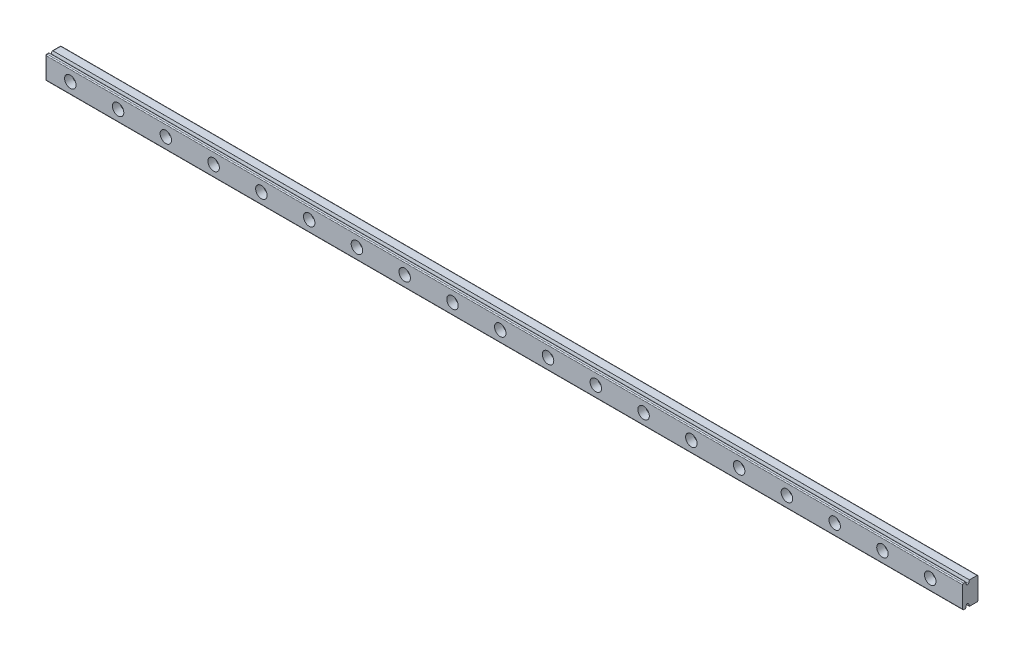
from build123d import *
from OCP.BRepFilletAPI import BRepFilletAPI_MakeChamfer

# Parameters (mm, degrees)
BOSS_EXTRUDE1_DEPTH = 500
SKETCH2_R           = 1.75
CUT_EXTRUDE1_DEPTH  = 10
SKETCH3_R           = 3
CUT_EXTRUDE2_DEPTH  = 4
CHAMFER1_SIZE       = 0.5
CHAMFER1_SIZE2      = 1.743707222
FILLET1_R           = 0.5
SKETCH_2_W          = 13.160064583
SKETCH_2_H          = 15.469848399
CUT_EXTRUDE_2_DEPTH = 20


with BuildPart() as part:
    # Sketch1 → Boss-Extrude1 (new body)
    with BuildSketch(Plane(origin=(0, 0, 0), x_dir=(0, 0, -1), z_dir=(1, 0, 0))):
        Polygon((-0.5, 6), (4, 6), (4, -6), (-0.5, -6), (-0.5, -4.25), (-2.5, -4.25), (-2.5, -6), (-4, -6), (-4, 6), (-2.5, 6), (-2.5, 4.25), (-0.5, 4.25), align=None)
    extrude(amount=BOSS_EXTRUDE1_DEPTH)

    # Sketch2 → Cut-Extrude1 (cut)
    with BuildSketch(Plane.XY.offset(4)):
        with Locations((13, 0)):
            Circle(SKETCH2_R)
        with Locations((38, 0)):
            Circle(SKETCH2_R)
        with Locations((63, 0)):
            Circle(SKETCH2_R)
        with Locations((88, 0)):
            Circle(SKETCH2_R)
        with Locations((113, 0)):
            Circle(SKETCH2_R)
        with Locations((138, 0)):
            Circle(SKETCH2_R)
        with Locations((163, 0)):
            Circle(SKETCH2_R)
        with Locations((188, 0)):
            Circle(SKETCH2_R)
        with Locations((213, 0)):
            Circle(SKETCH2_R)
        with Locations((238, 0)):
            Circle(SKETCH2_R)
        with Locations((263, 0)):
            Circle(SKETCH2_R)
        with Locations((288, 0)):
            Circle(SKETCH2_R)
        with Locations((313, 0)):
            Circle(SKETCH2_R)
        with Locations((338, 0)):
            Circle(SKETCH2_R)
        with Locations((363, 0)):
            Circle(SKETCH2_R)
        with Locations((388, 0)):
            Circle(SKETCH2_R)
        with Locations((413, 0)):
            Circle(SKETCH2_R)
        with Locations((438, 0)):
            Circle(SKETCH2_R)
        with Locations((463, 0)):
            Circle(SKETCH2_R)
        with Locations((488, 0)):
            Circle(SKETCH2_R)
    extrude(amount=-CUT_EXTRUDE1_DEPTH, mode=Mode.SUBTRACT)

    # Sketch3 → Cut-Extrude2 (cut)
    with BuildSketch(Plane.XY.offset(4)):
        with Locations((13, 0)):
            Circle(SKETCH3_R)
        with Locations((38, 0)):
            Circle(SKETCH3_R)
        with Locations((63, 0)):
            Circle(SKETCH3_R)
        with Locations((88, 0)):
            Circle(SKETCH3_R)
        with Locations((113, 0)):
            Circle(SKETCH3_R)
        with Locations((138, 0)):
            Circle(SKETCH3_R)
        with Locations((163, 0)):
            Circle(SKETCH3_R)
        with Locations((188, 0)):
            Circle(SKETCH3_R)
        with Locations((213, 0)):
            Circle(SKETCH3_R)
        with Locations((238, 0)):
            Circle(SKETCH3_R)
        with Locations((263, 0)):
            Circle(SKETCH3_R)
        with Locations((288, 0)):
            Circle(SKETCH3_R)
        with Locations((313, 0)):
            Circle(SKETCH3_R)
        with Locations((338, 0)):
            Circle(SKETCH3_R)
        with Locations((363, 0)):
            Circle(SKETCH3_R)
        with Locations((388, 0)):
            Circle(SKETCH3_R)
        with Locations((413, 0)):
            Circle(SKETCH3_R)
        with Locations((438, 0)):
            Circle(SKETCH3_R)
        with Locations((463, 0)):
            Circle(SKETCH3_R)
        with Locations((488, 0)):
            Circle(SKETCH3_R)
    extrude(amount=-CUT_EXTRUDE2_DEPTH, mode=Mode.SUBTRACT)

    # Chamfer1: one chamfer whose edges measure the first distance from different faces: ONE call of the kernel's chamfer builder (chamfer() names one face for all edges)
    chamfer1_edges_1 = [part.edges().sort_by_distance(p)[0] for p in [
        (250, -4.25, 0.5),
        (250, -4.25, 2.5),
    ]]
    chamfer1_side_1 = [part.faces().sort_by_distance(p)[0] for p in [
        (250, -4.25, 1.5),
    ]]
    chamfer1_edges_2 = [part.edges().sort_by_distance(p)[0] for p in [
        (250, 4.25, 2.5),
        (250, 4.25, 0.5),
    ]]
    chamfer1_side_2 = [part.faces().sort_by_distance(p)[0] for p in [
        (250, 4.25, 1.5),
    ]]
    chamfer1 = BRepFilletAPI_MakeChamfer(part.part.solid().wrapped)
    for e in chamfer1_edges_1:
        chamfer1.Add(CHAMFER1_SIZE, CHAMFER1_SIZE2, e.wrapped, chamfer1_side_1[0].wrapped)  # the first distance lies on this face
    for e in chamfer1_edges_2:
        chamfer1.Add(CHAMFER1_SIZE, CHAMFER1_SIZE2, e.wrapped, chamfer1_side_2[0].wrapped)  # the first distance lies on this face
    add(Compound.cast(chamfer1.Shape()), mode=Mode.REPLACE)

    # Fillet1
    fillet1_edges = [part.edges().sort_by_distance(p)[0] for p in [
        (500, -6, -1.75),
        (500, 0, -4),
        (500, 6, -1.75),
        (500, 6, 3.25),
        (500, 0, 4),
        (500, -6, 3.25),
        (0, -6, 3.25),
        (0, -6, -1.75),
        (0, 0, -4),
        (0, 6, -1.75),
        (0, 6, 3.25),
        (0, 0, 4),
        (250, -4.25, 1),
        (250, -4.25, 2),
        (250, 4.25, 2),
        (250, 4.25, 1),
        (250, -6, 4),
        (250, 6, 4),
        (250, -6, -4),
        (250, 6, -4),
    ]]
    fillet(fillet1_edges, radius=FILLET1_R)

    # 草图2 → 切除-拉伸2 (cut)
    with BuildSketch(Plane(origin=(500, 0, 0), x_dir=(0, 0, -1), z_dir=(1, 0, 0))):
        with Locations((1.375889743, -0.313674346)):
            Rectangle(SKETCH_2_W, SKETCH_2_H)
    extrude(amount=-CUT_EXTRUDE_2_DEPTH, mode=Mode.SUBTRACT)


solid = part.part
